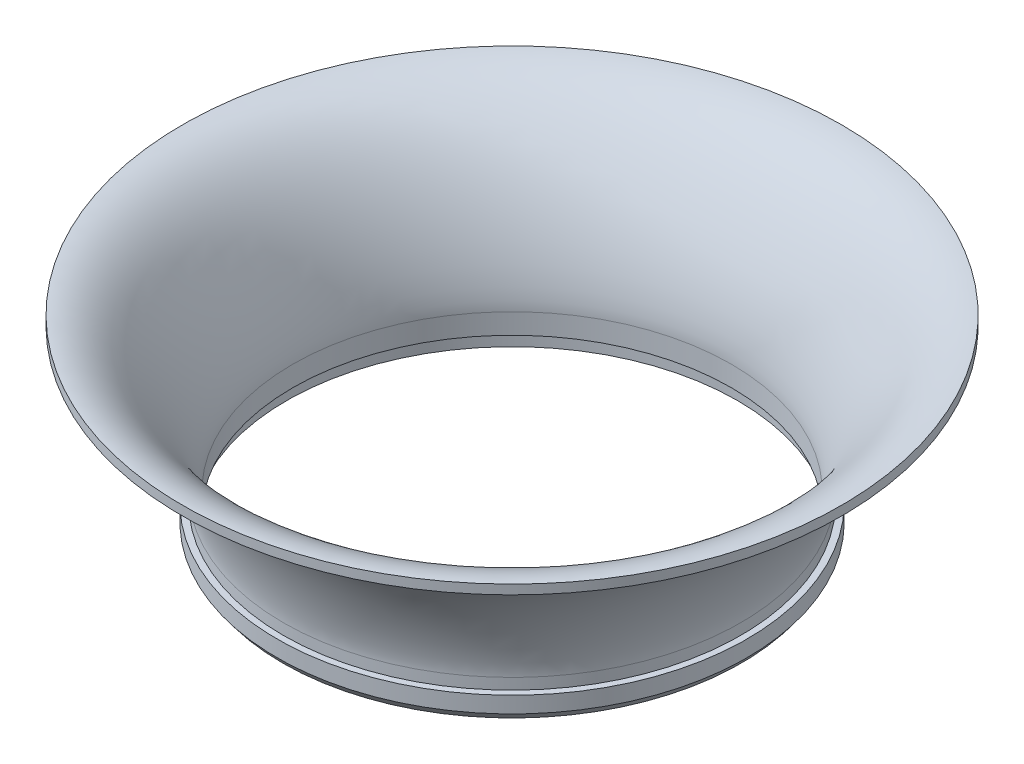
from build123d import *


with BuildPart() as part:
    # Sketch1 → Revolve1 (revolve)
    with BuildSketch(Plane.XY, mode=Mode.PRIVATE) as revolve1_sk:
        with BuildLine():
            Line((-36.8, 0), (-36.2, 0))
            Line((-36.2, 0), (-36.2, 2.3))
            Line((-36.2, 2.3), (-35.2, 2.3))
            Line((-35.2, 2.3), (-35.2, 5.567567568))
            add(Edge.make_bspline(
                [(-35.2, 5.567567568), (-35.2, 12.055305215), (-42.368844713, 30), (-52.9, 30)],
                knots=[0, 0, 0, 0, 1, 1, 1, 1], degree=3))
            Line((-52.9, 30), (-52.9, 28.5))
            add(Edge.make_bspline(
                [(-36.7, 5.567567568), (-36.7, 5.750392821), (-36.711708248, 6.096054894), (-36.785605066, 6.944918159), (-36.975164747, 8.157626022), (-37.357141313, 9.826359164), (-38.065522063, 12.250943187), (-39.309117401, 15.537059232), (-41.319298351, 19.512738418), (-43.780706571, 23.156932853), (-46.610142999, 26.110747792), (-49.669673513, 28.038114203), (-51.808561364, 28.5), (-52.9, 28.5)],
                knots=[0, 0, 0, 0, 0.03125, 0.0625, 0.125, 0.1875, 0.25, 0.375, 0.5, 0.625, 0.75, 0.875, 1, 1, 1, 1], degree=3))
            Line((-36.7, 5.567567568), (-36.7, 3.8))
            Line((-36.7, 3.8), (-37.7, 3.8))
            Line((-37.7, 3.8), (-37.7, 1.2))
            Line((-37.7, 1.2), (-36.8, 0))
        make_face()
    revolve(revolve1_sk.sketch.rotate(Axis((0, 0, 0), (0, 1, 0)), 270), axis=Axis((0, 0, 0), (0, 1, 0)))


solid = part.part
